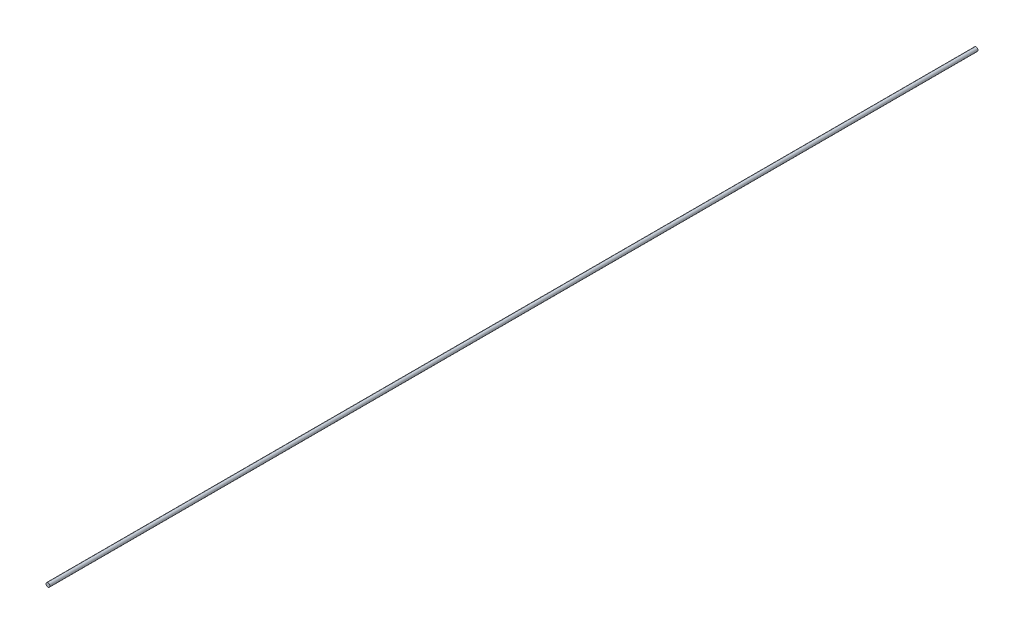
from build123d import *

# Parameters (mm, degrees)
SKETCH1_R           = 1.5875
BOSS_EXTRUDE1_DEPTH = 761.999746


with BuildPart() as part:
    # Sketch1 → Boss-Extrude1 (new body)
    with BuildSketch(Plane.XY):
        with Locations((-44.721526796, -1.872029509)):
            Circle(SKETCH1_R)
    extrude(amount=-BOSS_EXTRUDE1_DEPTH)


solid = part.part
